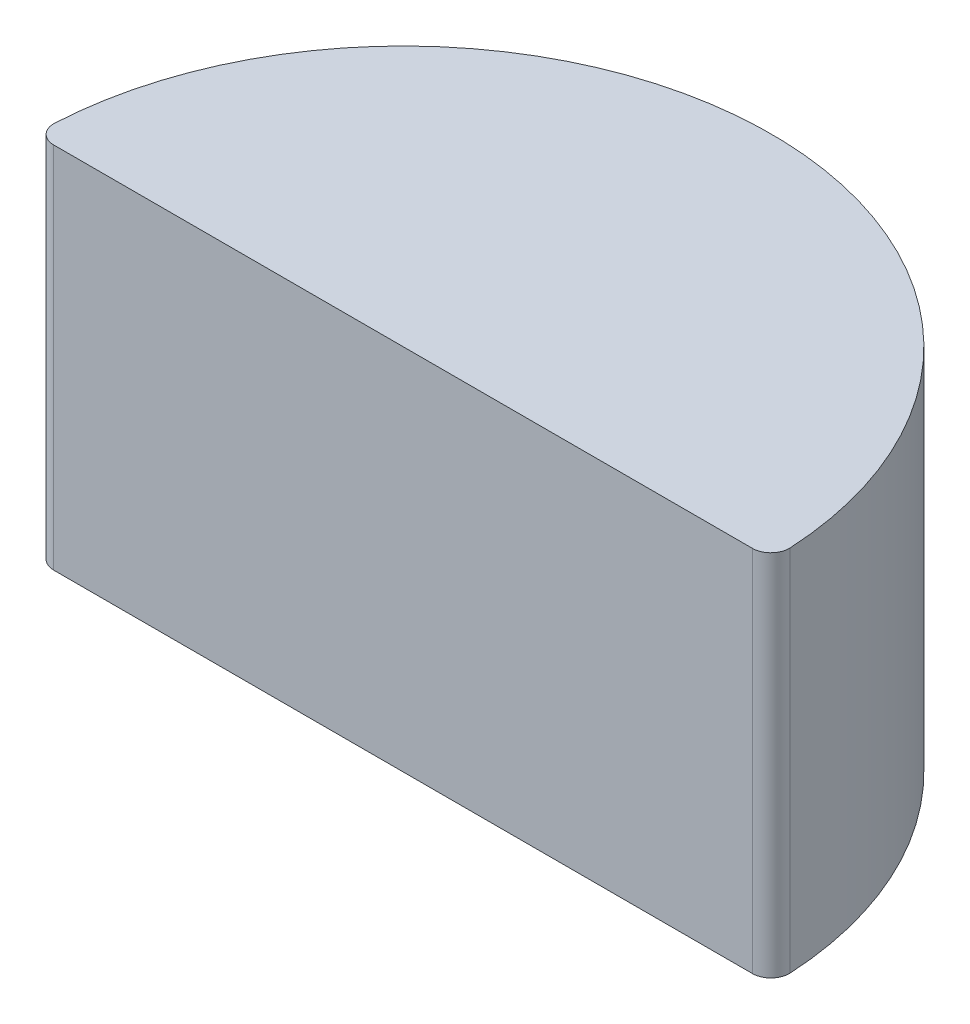
from build123d import *

# Parameters (mm, degrees)
BOSS_EXTRUDE1_DEPTH = 20
FILLET1_R           = 1


with BuildPart() as part:
    # Sketch1 → Boss-Extrude1 (new body)
    with BuildSketch(Plane(origin=(0, 0, 0), x_dir=(1, 0, 0), z_dir=(0, 1, 0))):
        with BuildLine():
            Line((0, 0), (40, 0))
            ThreePointArc((40, 0), (20, 20), (0, 0))
        make_face()
    extrude(amount=BOSS_EXTRUDE1_DEPTH)

    # Fillet1
    fillet1_edges = [part.edges().sort_by_distance(p)[0] for p in [
        (40, 10, 0),
        (0, 10, 0),
    ]]
    fillet(fillet1_edges, radius=FILLET1_R)


solid = part.part
